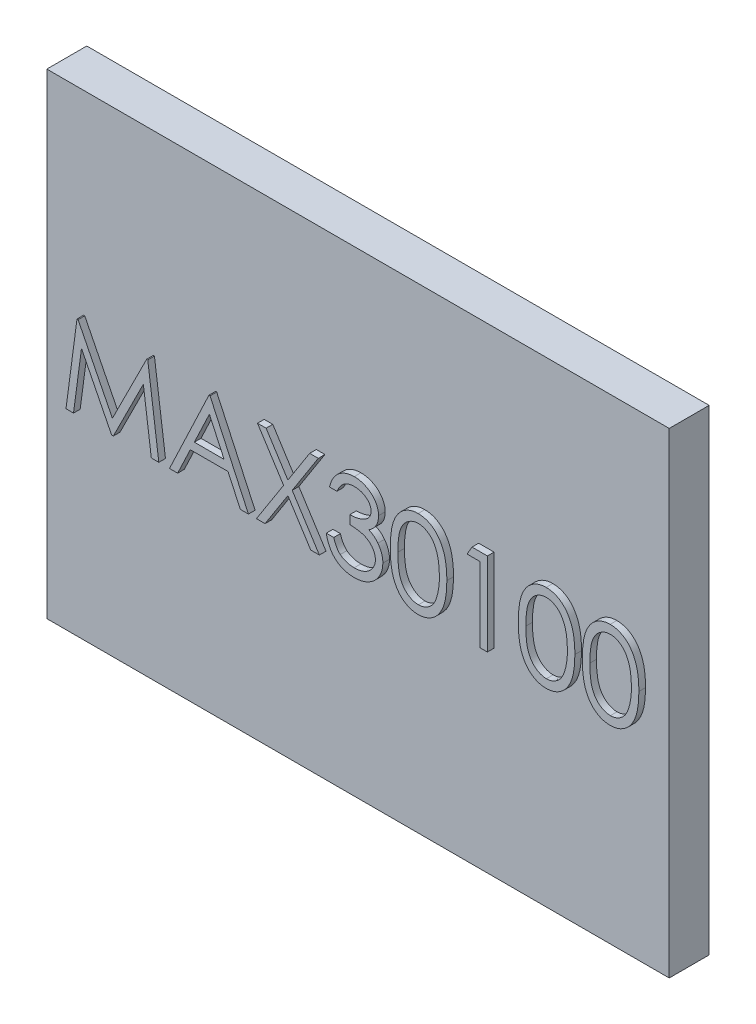
from build123d import *

# Parameters (mm, degrees)
SKETCH1_W           = 18.7
SKETCH1_H           = 14.3
BOSS_EXTRUDE1_DEPTH = 1.2
BOSS_EXTRUDE2_DEPTH = 0.2


with BuildPart() as part:
    # Sketch1 → Boss-Extrude1 (new body)
    with BuildSketch(Plane.XY):
        Rectangle(SKETCH1_W, SKETCH1_H)
    extrude(amount=BOSS_EXTRUDE1_DEPTH)

    # Sketch2 → Boss-Extrude2 (add)
    # profile 1 of 8: a face of its own
    with BuildSketch(Plane.XY.offset(1.2)):
        Polygon((-8.573717949, -1.2), (-8.243689904, 1.3), (-8.211638622, 1.3), (-7.179487179, -0.751282051), (-6.149839744, 1.3), (-6.11728766, 1.3), (-5.78525641, -1.2), (-6.010616987, -1.2), (-6.25, 0.598878205), (-7.15244391, -1.2), (-7.20302484, -1.2), (-8.108974359, 0.602884615), (-8.347856571, -1.2), align=None)
    # profile 2 of 8: a face of its own
    with BuildSketch(Plane.XY.offset(1.2)):
        Polygon((-4.246794872, 1.3), (-3.092948718, -1.2), (-3.336838942, -1.2), (-3.706430288, -0.398717949), (-4.83974359, -0.398717949), (-5.219851763, -1.2), (-5.46474359, -1.2), (-4.278846154, 1.3), align=None)
        Polygon((-4.265324519, 0.812720353), (-4.718048878, -0.142307692), (-3.824619391, -0.142307692), align=None, mode=Mode.SUBTRACT)
    # profile 3 of 8: a face of its own
    with BuildSketch(Plane.XY.offset(1.2)):
        Polygon((-2.820512821, 1.3), (-2.561598558, 1.3), (-1.907051282, 0.277363782), (-1.252504006, 1.3), (-0.993589744, 1.3), (-1.77734375, 0.075040064), (-0.961538462, -1.2), (-1.220452724, -1.2), (-1.907051282, -0.127283654), (-2.59364984, -1.2), (-2.852564103, -1.2), (-2.036258013, 0.075040064), align=None)
    # profile 4 of 8: a face of its own
    with BuildSketch(Plane.XY.offset(1.2)):
        with BuildLine():
            Line((-0.432692308, 0.723076923), (-0.657051282, 0.723076923))
            add(Edge.make_bspline(
                [(-0.657051282, 0.723076923), (-0.650973032, 0.748242983), (-0.639090549, 0.797440572), (-0.614306568, 0.867731473), (-0.5873071, 0.934248274), (-0.554886311, 0.995745469), (-0.519522915, 1.053458971), (-0.479006685, 1.106079774), (-0.435206884, 1.154946178), (-0.386760491, 1.198312776), (-0.335954304, 1.237582583), (-0.282072433, 1.271064767), (-0.226198938, 1.299867733), (-0.1679467, 1.32359647), (-0.107142291, 1.341471844), (-0.044335418, 1.354440991), (0.020638511, 1.362863215), (0.064743933, 1.363685189), (0.087139423, 1.364102564)],
                knots=[0, 0, 0, 0, 1.162005537, 2.271625781, 3.343758855, 4.383309926, 5.390229558, 6.379919256, 7.361854164, 8.333198761, 9.295911338, 10.242430842, 11.177959212, 12.116337295, 13.062827104, 14.020064771, 14.994644689, 16, 16, 16, 16], degree=3))
            add(Edge.make_bspline(
                [(0.087139423, 1.364102564), (0.119769953, 1.3631174), (0.184319247, 1.36116856), (0.279149994, 1.343372534), (0.370597722, 1.315211725), (0.457661471, 1.27630192), (0.53853178, 1.228310982), (0.610486199, 1.171193313), (0.672549421, 1.106050955), (0.724616834, 1.034099123), (0.76538469, 0.957202331), (0.795446385, 0.878059361), (0.813747586, 0.796857953), (0.816119412, 0.742031325), (0.817307692, 0.714563301)],
                knots=[0, 0, 0, 0, 1.083050992, 2.142477498, 3.193116406, 4.255571735, 5.30263384, 6.308962982, 7.297363603, 8.282367274, 9.249857812, 10.179914175, 11.08814088, 12, 12, 12, 12], degree=3))
            add(Edge.make_bspline(
                [(0.817307692, 0.714563301), (0.816476556, 0.688129876), (0.814850151, 0.636403766), (0.801040361, 0.560888411), (0.777800173, 0.489715839), (0.745607486, 0.422586438), (0.70393495, 0.359925838), (0.653454452, 0.301593059), (0.593809694, 0.247329374), (0.548610452, 0.216244037), (0.525340545, 0.200240385)],
                knots=[0, 0, 0, 0, 1.024540389, 2.004866551, 2.965041327, 3.920577974, 4.882998113, 5.874504559, 6.905732034, 8, 8, 8, 8], degree=3))
            add(Edge.make_bspline(
                [(0.525340545, 0.200240385), (0.551934655, 0.187398834), (0.60462528, 0.161956007), (0.676447087, 0.112059037), (0.741645569, 0.05444736), (0.778005368, 0.009488323), (0.796274038, -0.013100962)],
                knots=[0, 0, 0, 0, 1.015518401, 2.012035669, 3.001164323, 4, 4, 4, 4], degree=3))
            add(Edge.make_bspline(
                [(0.796274038, -0.013100962), (0.808303569, -0.029570784), (0.832165637, -0.062240725), (0.86161959, -0.114766743), (0.888340386, -0.16787495), (0.909161971, -0.222988811), (0.925286162, -0.279469535), (0.936811899, -0.337414104), (0.943972, -0.396869834), (0.944997394, -0.437093034), (0.945512821, -0.457311699)],
                knots=[0, 0, 0, 0, 1.025084078, 2.033381695, 3.024893161, 4.013698104, 4.991890475, 5.976764909, 6.982997093, 8, 8, 8, 8], degree=3))
            add(Edge.make_bspline(
                [(0.945512821, -0.457311699), (0.944231025, -0.492318642), (0.941673467, -0.562167787), (0.918813413, -0.665364016), (0.883375384, -0.766239375), (0.833049002, -0.862721403), (0.771715067, -0.952993104), (0.698745549, -1.033761896), (0.614969543, -1.103189471), (0.521536937, -1.161196776), (0.420310417, -1.207566721), (0.312042137, -1.239750608), (0.198292098, -1.260712037), (0.120286886, -1.2629598), (0.080629006, -1.264102564)],
                knots=[0, 0, 0, 0, 0.955779014, 1.907060117, 2.875433937, 3.871313158, 4.872415639, 5.851225146, 6.836215519, 7.83643374, 8.849228613, 9.86973379, 10.916971861, 12, 12, 12, 12], degree=3))
            add(Edge.make_bspline(
                [(0.080629006, -1.264102564), (0.053900935, -1.263482412), (0.001309003, -1.262262159), (-0.076007782, -1.253920301), (-0.149808996, -1.238684583), (-0.220194423, -1.218182222), (-0.287226592, -1.19218812), (-0.350700953, -1.159817622), (-0.411008019, -1.121737977), (-0.467578699, -1.0774997), (-0.520406247, -1.028013029), (-0.568086764, -0.972399451), (-0.611415188, -0.911687019), (-0.649231358, -0.845170551), (-0.683257753, -0.773709652), (-0.711244151, -0.696389296), (-0.7358767, -0.613900709), (-0.747329174, -0.556416609), (-0.753205128, -0.526923077)],
                knots=[0, 0, 0, 0, 1.048658725, 2.063410685, 3.046034179, 4.001477787, 4.936774919, 5.862367409, 6.792675028, 7.730719943, 8.675894397, 9.627829632, 10.600096036, 11.597688215, 12.626045268, 13.701542398, 14.82072376, 16, 16, 16, 16], degree=3))
            Line((-0.753205128, -0.526923077), (-0.528846154, -0.526923077))
            add(Edge.make_bspline(
                [(-0.528846154, -0.526923077), (-0.523000946, -0.546172372), (-0.511631508, -0.583613923), (-0.492278438, -0.637499856), (-0.470229672, -0.686898465), (-0.446576416, -0.732172124), (-0.421734669, -0.773766697), (-0.393938294, -0.810582318), (-0.365246047, -0.844236034), (-0.343617938, -0.863196471), (-0.333032853, -0.872475962)],
                knots=[0, 0, 0, 0, 1.198163088, 2.33053128, 3.407730985, 4.417276592, 5.372219308, 6.28897303, 7.162600585, 8, 8, 8, 8], degree=3))
            add(Edge.make_bspline(
                [(-0.333032853, -0.872475962), (-0.319035298, -0.883267629), (-0.291083396, -0.904817651), (-0.245534659, -0.932318815), (-0.197631169, -0.956148118), (-0.146334973, -0.974350758), (-0.092752995, -0.989763373), (-0.036019162, -0.999849458), (0.023365993, -1.00676958), (0.063914395, -1.007380246), (0.084635417, -1.007692308)],
                knots=[0, 0, 0, 0, 0.946170439, 1.889420265, 2.845303464, 3.807233317, 4.801018734, 5.828864929, 6.890507805, 8, 8, 8, 8], degree=3))
            add(Edge.make_bspline(
                [(0.084635417, -1.007692308), (0.108030776, -1.007252375), (0.153778381, -1.006392126), (0.220531852, -0.998480907), (0.284037171, -0.986959183), (0.343589261, -0.969164195), (0.399968195, -0.947177872), (0.452383659, -0.919571869), (0.501523735, -0.887182782), (0.546759024, -0.850369097), (0.587434387, -0.810068029), (0.623248325, -0.767915835), (0.653694512, -0.724090243), (0.67825421, -0.678348728), (0.697647461, -0.630880707), (0.710849747, -0.581552972), (0.7200294, -0.53076921), (0.720776981, -0.496248518), (0.721153846, -0.478846154)],
                knots=[0, 0, 0, 0, 1.217147791, 2.380027433, 3.494444702, 4.572153297, 5.609568379, 6.639424714, 7.649109417, 8.668170816, 9.669597737, 10.625200337, 11.543417969, 12.441394052, 13.322311151, 14.205496177, 15.095365482, 16, 16, 16, 16], degree=3))
            add(Edge.make_bspline(
                [(0.721153846, -0.478846154), (0.720060774, -0.45555234), (0.717880068, -0.40908062), (0.701231082, -0.340710924), (0.673846179, -0.274837058), (0.635508671, -0.212582922), (0.588840294, -0.15488585), (0.534293932, -0.10340622), (0.471416626, -0.060927583), (0.413545291, -0.031578543), (0.362284464, -0.011552061), (0.318416333, 0.0017872), (0.269304473, 0.013082668), (0.215542795, 0.023591433), (0.156726212, 0.032535254), (0.092918757, 0.039993693), (0.024107498, 0.04596158), (-0.023529049, 0.048626648), (-0.048076923, 0.05)],
                knots=[0, 0, 0, 0, 1.07054697, 2.135767047, 3.216561865, 4.33974944, 5.486079747, 6.621378074, 7.775625952, 8.963672916, 9.598146892, 10.304877434, 11.070270905, 11.915000392, 12.823868403, 13.805723172, 14.86925407, 16, 16, 16, 16], degree=3))
            Line((-0.048076923, 0.05), (-0.048076923, 0.306410256))
            add(Edge.make_bspline(
                [(-0.048076923, 0.306410256), (-0.017147519, 0.306935116), (0.043435586, 0.307963188), (0.131931518, 0.320397481), (0.216555312, 0.337597929), (0.295431556, 0.363944495), (0.367323494, 0.394544707), (0.429694639, 0.430153428), (0.481671173, 0.469735392), (0.523000509, 0.513901542), (0.554092816, 0.561269433), (0.576826242, 0.610638474), (0.590255047, 0.662441375), (0.592047666, 0.697794709), (0.592948718, 0.715564904)],
                knots=[0, 0, 0, 0, 1.321986639, 2.589447074, 3.816329219, 5.01088745, 6.139805852, 7.153945165, 8.075214402, 8.924034688, 9.728124013, 10.488707548, 11.240355623, 12, 12, 12, 12], degree=3))
            add(Edge.make_bspline(
                [(0.592948718, 0.715564904), (0.59265271, 0.728620436), (0.592063817, 0.754593798), (0.58463719, 0.792540276), (0.57347716, 0.829326666), (0.558134497, 0.86479653), (0.53759864, 0.898703869), (0.513022936, 0.931337761), (0.483760007, 0.962511889), (0.450227545, 0.99156926), (0.414219113, 1.019261572), (0.374754988, 1.042771313), (0.333025077, 1.062874929), (0.288983181, 1.079453144), (0.242486373, 1.091924065), (0.193753118, 1.100878237), (0.142690487, 1.106476562), (0.107853535, 1.107282573), (0.090144231, 1.107692308)],
                knots=[0, 0, 0, 0, 0.884392785, 1.759457502, 2.611959086, 3.489218968, 4.37281399, 5.2945488, 6.255912374, 7.266815255, 8.301784654, 9.332968512, 10.37626691, 11.440494194, 12.520033166, 13.637162961, 14.798855837, 16, 16, 16, 16], degree=3))
            add(Edge.make_bspline(
                [(0.090144231, 1.107692308), (0.061678754, 1.106698478), (0.006079056, 1.104757297), (-0.074074456, 1.087755144), (-0.148588266, 1.060627942), (-0.205544456, 1.028247213), (-0.247603438, 0.996282618), (-0.277658394, 0.968366628), (-0.307173044, 0.937343182), (-0.33420567, 0.901301485), (-0.361544225, 0.86268235), (-0.386433198, 0.819522577), (-0.410618692, 0.77294801), (-0.425191942, 0.740022556), (-0.432692308, 0.723076923)],
                knots=[0, 0, 0, 0, 1.472543308, 2.876219568, 4.221790263, 5.565193594, 6.249813518, 6.953379497, 7.687249741, 8.463570142, 9.283606569, 10.136032583, 11.040678096, 12, 12, 12, 12], degree=3))
        make_face()
    # profile 5 of 8: a face of its own
    with BuildSketch(Plane.XY.offset(1.2)):
        with BuildLine():
            add(Edge.make_bspline(
                [(1.169871795, 0.048998397), (1.170106094, 0.08906796), (1.170561222, 0.166903663), (1.17562438, 0.280321265), (1.184035339, 0.386721471), (1.195562034, 0.486109375), (1.209589162, 0.578510636), (1.22831451, 0.663678319), (1.249609369, 0.74200661), (1.274289687, 0.81375093), (1.302138108, 0.879877861), (1.332448294, 0.941610148), (1.366423147, 0.998854385), (1.402120942, 1.052524235), (1.440986708, 1.10174116), (1.481914415, 1.147200205), (1.52650147, 1.187850741), (1.57323219, 1.224883814), (1.622529665, 1.257347722), (1.672988712, 1.285942536), (1.724956645, 1.310371012), (1.778575347, 1.329578466), (1.833362888, 1.345443357), (1.889510793, 1.356292605), (1.947111767, 1.363118968), (1.985991363, 1.363771588), (2.005709135, 1.364102564)],
                knots=[0, 0, 0, 0, 1.646270934, 3.197905019, 4.663502075, 6.030701355, 7.308322542, 8.50163776, 9.611534131, 10.641858119, 11.616356847, 12.558055219, 13.465016945, 14.349605745, 15.204443733, 16.039544428, 16.859896111, 17.680448484, 18.487036065, 19.28249412, 20.06191084, 20.843045899, 21.620316918, 22.403196591, 23.190181807, 24, 24, 24, 24], degree=3))
            add(Edge.make_bspline(
                [(2.005709135, 1.364102564), (2.025591619, 1.363754125), (2.065131626, 1.363061188), (2.123589036, 1.356401229), (2.180695952, 1.345350427), (2.236208908, 1.329692588), (2.290583899, 1.310267105), (2.343395618, 1.285919164), (2.394972105, 1.257577116), (2.444493739, 1.224274346), (2.492504179, 1.187144149), (2.537824152, 1.145170814), (2.580457785, 1.098778158), (2.620940146, 1.048462541), (2.658122715, 0.993258909), (2.69353231, 0.934127402), (2.725226621, 0.870033927), (2.755751389, 0.802047878), (2.782099237, 0.728288122), (2.805860841, 0.649170436), (2.825060104, 0.563760302), (2.841052441, 0.472505842), (2.853441653, 0.375071925), (2.862464968, 0.271667414), (2.867231458, 0.162224278), (2.868129101, 0.087397243), (2.868589744, 0.048998397)],
                knots=[0, 0, 0, 0, 0.810914788, 1.612654377, 2.396697861, 3.181598691, 3.963628158, 4.749916497, 5.551656086, 6.361998678, 7.18212741, 8.025565596, 8.878627764, 9.750805457, 10.657531673, 11.591944965, 12.560506719, 13.57287815, 14.630710178, 15.753379473, 16.941251878, 18.199788006, 19.531962791, 20.947069417, 22.433333509, 24, 24, 24, 24], degree=3))
            add(Edge.make_bspline(
                [(2.868589744, 0.048998397), (2.868124326, 0.010767035), (2.867217479, -0.063725217), (2.862518403, -0.172675913), (2.853262238, -0.275531659), (2.841683675, -0.372539132), (2.825647272, -0.463294574), (2.805929296, -0.548112037), (2.784036209, -0.627357802), (2.757011356, -0.700382668), (2.727432277, -0.768205327), (2.695249994, -0.831539004), (2.660771547, -0.890943499), (2.623208158, -0.945943318), (2.583170005, -0.996928074), (2.539800156, -1.042997804), (2.494321167, -1.08526257), (2.446169441, -1.122870875), (2.395875476, -1.155788593), (2.344476135, -1.185227057), (2.291059433, -1.208964696), (2.236835895, -1.229346869), (2.181029919, -1.24491862), (2.123711069, -1.25568566), (2.0651709, -1.26323698), (2.025598354, -1.263813037), (2.005709135, -1.264102564)],
                knots=[0, 0, 0, 0, 1.561518951, 3.042555995, 4.452378317, 5.7783523, 7.031515105, 8.214008947, 9.334062868, 10.386615937, 11.391082383, 12.354592575, 13.286541444, 14.194233754, 15.072674879, 15.931287219, 16.775624067, 17.606195743, 18.42308326, 19.229000347, 20.022332153, 20.807536673, 21.593273796, 22.3848459, 23.188221202, 24, 24, 24, 24], degree=3))
            add(Edge.make_bspline(
                [(2.005709135, -1.264102564), (1.98599191, -1.263769453), (1.947113393, -1.263112623), (1.889504517, -1.256317101), (1.833588486, -1.245391741), (1.779089376, -1.230094167), (1.72572758, -1.211369284), (1.674230232, -1.186973795), (1.624024744, -1.158878032), (1.575245061, -1.126881302), (1.528807803, -1.090222957), (1.484451656, -1.049677037), (1.443290928, -1.004231743), (1.40498086, -0.954604655), (1.368570797, -0.901252339), (1.335078388, -0.843446358), (1.304099206, -0.781415922), (1.275782427, -0.714760272), (1.250676239, -0.642506752), (1.228499305, -0.563828767), (1.210989192, -0.478031884), (1.196001367, -0.385805193), (1.183912522, -0.286752386), (1.175659432, -0.180819687), (1.170558493, -0.06807311), (1.170104871, 0.009262444), (1.169871795, 0.048998397)],
                knots=[0, 0, 0, 0, 0.810891512, 1.598919785, 2.382837074, 3.152667961, 3.926044502, 4.706494248, 5.493654104, 6.291793342, 7.103789334, 7.925228297, 8.761435821, 9.622817696, 10.50288917, 11.416980706, 12.369136599, 13.353924996, 14.394355917, 15.514179734, 16.714354668, 17.994756427, 19.357759367, 20.818452758, 22.365282078, 24, 24, 24, 24], degree=3))
        make_face()
        with BuildLine():
            add(Edge.make_bspline(
                [(1.394230769, 0.05), (1.394316089, 0.016608072), (1.394481677, -0.048199103), (1.398807534, -0.14237286), (1.404700557, -0.23020881), (1.412301484, -0.311818478), (1.423589304, -0.38692563), (1.43623701, -0.456046832), (1.451628502, -0.518816288), (1.469839229, -0.575664724), (1.490581441, -0.627556916), (1.513228487, -0.675843498), (1.537557575, -0.721094881), (1.564785539, -0.762904601), (1.594439156, -0.801409004), (1.625848627, -0.837289599), (1.660186187, -0.869287442), (1.70768886, -0.907663767), (1.770400627, -0.947320292), (1.849415238, -0.981853213), (1.930606989, -1.003554967), (1.985715025, -1.006314793), (2.013221154, -1.007692308)],
                knots=[0, 0, 0, 0, 1.459021318, 2.831673884, 4.118529203, 5.306027144, 6.411944654, 7.436330062, 8.375795394, 9.233974572, 10.042671642, 10.816086306, 11.563610507, 12.285937304, 12.993564865, 13.685989202, 14.367179055, 15.041617293, 16.353048772, 17.594441528, 18.799311195, 20, 20, 20, 20], degree=3))
            add(Edge.make_bspline(
                [(2.013221154, -1.007692308), (2.040905205, -1.006551036), (2.09621615, -1.004270848), (2.177026004, -0.98227175), (2.255476197, -0.949079222), (2.316956154, -0.909831003), (2.363729399, -0.872453625), (2.397241535, -0.840586019), (2.428000141, -0.804903257), (2.457173052, -0.76640376), (2.483929535, -0.724351986), (2.508260347, -0.678950146), (2.530462738, -0.630072162), (2.543112057, -0.59595092), (2.549579327, -0.578505609)],
                knots=[0, 0, 0, 0, 1.353760809, 2.704726607, 4.075137775, 5.516104923, 6.260822281, 7.007110065, 7.778089737, 8.566572457, 9.372053459, 10.217411131, 11.088608312, 12, 12, 12, 12], degree=3))
            add(Edge.make_bspline(
                [(2.549579327, -0.578505609), (2.557116304, -0.556198652), (2.5724196, -0.510905963), (2.592142295, -0.440646212), (2.607674723, -0.366929952), (2.621648556, -0.290197726), (2.631186453, -0.209883654), (2.638863463, -0.126236237), (2.643385382, -0.039192406), (2.643945918, 0.019946873), (2.644230769, 0.05)],
                knots=[0, 0, 0, 0, 0.884706709, 1.796334032, 2.740027952, 3.714592787, 4.726048262, 5.777819803, 6.87074269, 8, 8, 8, 8], degree=3))
            add(Edge.make_bspline(
                [(2.644230769, 0.05), (2.643837777, 0.080048266), (2.643069, 0.138829098), (2.640130437, 0.224913513), (2.63254217, 0.306676199), (2.624114228, 0.384469394), (2.611687641, 0.457862467), (2.598289208, 0.527469828), (2.580288342, 0.592429132), (2.561059931, 0.653757404), (2.539052506, 0.710757872), (2.514826981, 0.763696291), (2.488954296, 0.812828237), (2.460852696, 0.858018909), (2.43085578, 0.899470726), (2.398171816, 0.936352579), (2.364097264, 0.969807556), (2.316370703, 1.007995106), (2.253889067, 1.046932031), (2.176142176, 1.082764717), (2.095234573, 1.103342068), (2.040539249, 1.106243274), (2.013221154, 1.107692308)],
                knots=[0, 0, 0, 0, 1.31362396, 2.569729283, 3.763502607, 4.902122613, 5.988968491, 7.01645872, 7.998833611, 8.933434873, 9.825090667, 10.667526885, 11.477055099, 12.250526234, 12.991942729, 13.710640831, 14.402115721, 15.076753259, 16.378508321, 17.609869233, 18.806226677, 20, 20, 20, 20], degree=3))
            add(Edge.make_bspline(
                [(2.013221154, 1.107692308), (1.985570731, 1.106241274), (1.930219513, 1.103336564), (1.848470974, 1.082841383), (1.770110722, 1.047117836), (1.707794312, 1.007866141), (1.660034464, 0.970481633), (1.626403969, 0.938062738), (1.594870989, 0.902601127), (1.565822632, 0.863742617), (1.538616001, 0.82198164), (1.513629563, 0.776989665), (1.491117185, 0.728538691), (1.470342516, 0.676669808), (1.452076239, 0.619826277), (1.437009123, 0.557134138), (1.423089799, 0.488232787), (1.413236035, 0.412718853), (1.40447621, 0.331088743), (1.398846676, 0.243033516), (1.394467206, 0.148701816), (1.39431116, 0.08355956), (1.394230769, 0.05)],
                knots=[0, 0, 0, 0, 1.207732386, 2.417664972, 3.655092373, 4.956220595, 5.625982001, 6.301752483, 6.994047911, 7.697131622, 8.419323945, 9.170223765, 9.943494443, 10.752040957, 11.610060368, 12.549350801, 13.567764191, 14.679664412, 15.874934091, 17.154273443, 18.533957287, 20, 20, 20, 20], degree=3))
        make_face(mode=Mode.SUBTRACT)
    # profile 6 of 8: a face of its own
    with BuildSketch(Plane.XY.offset(1.2)):
        Polygon((3.624298878, 1.3), (4.086538462, 1.3), (4.086538462, -1.2), (3.862179487, -1.2), (3.862179487, 1.043589744), (3.477564103, 1.043589744), align=None)
    # profile 7 of 8: a face of its own
    with BuildSketch(Plane.XY.offset(1.2)):
        with BuildLine():
            add(Edge.make_bspline(
                [(5.016025641, 0.048998397), (5.01625994, 0.08906796), (5.016715068, 0.166903663), (5.021778226, 0.280321265), (5.030189185, 0.386721471), (5.04171588, 0.486109375), (5.055743009, 0.578510636), (5.074468356, 0.663678319), (5.095763215, 0.74200661), (5.120443534, 0.81375093), (5.148291954, 0.879877861), (5.17860214, 0.941610148), (5.212576994, 0.998854385), (5.248274789, 1.052524235), (5.287140554, 1.10174116), (5.328068262, 1.147200205), (5.372655316, 1.187850741), (5.419386036, 1.224883814), (5.468683511, 1.257347722), (5.519142558, 1.285942536), (5.571110491, 1.310371012), (5.624729193, 1.329578466), (5.679516734, 1.345443357), (5.735664639, 1.356292605), (5.793265613, 1.363118968), (5.832145209, 1.363771588), (5.851862981, 1.364102564)],
                knots=[0, 0, 0, 0, 1.646270934, 3.197905019, 4.663502075, 6.030701355, 7.308322542, 8.50163776, 9.611534131, 10.641858119, 11.616356847, 12.558055219, 13.465016945, 14.349605745, 15.204443733, 16.039544428, 16.859896111, 17.680448484, 18.487036065, 19.28249412, 20.06191084, 20.843045899, 21.620316918, 22.403196591, 23.190181807, 24, 24, 24, 24], degree=3))
            add(Edge.make_bspline(
                [(5.851862981, 1.364102564), (5.871745465, 1.363754125), (5.911285472, 1.363061188), (5.969742883, 1.356401229), (6.026849798, 1.345350427), (6.082362754, 1.329692588), (6.136737745, 1.310267105), (6.189549464, 1.285919164), (6.241125951, 1.257577116), (6.290647585, 1.224274346), (6.338658025, 1.187144149), (6.383977998, 1.145170814), (6.426611631, 1.098778158), (6.467093992, 1.048462541), (6.504276562, 0.993258909), (6.539686156, 0.934127402), (6.571380467, 0.870033927), (6.601905235, 0.802047878), (6.628253083, 0.728288122), (6.652014687, 0.649170436), (6.67121395, 0.563760302), (6.687206287, 0.472505842), (6.699595499, 0.375071925), (6.708618815, 0.271667414), (6.713385304, 0.162224278), (6.714282948, 0.087397243), (6.71474359, 0.048998397)],
                knots=[0, 0, 0, 0, 0.810914788, 1.612654377, 2.396697861, 3.181598691, 3.963628158, 4.749916497, 5.551656086, 6.361998678, 7.18212741, 8.025565596, 8.878627764, 9.750805457, 10.657531673, 11.591944965, 12.560506719, 13.57287815, 14.630710178, 15.753379473, 16.941251878, 18.199788006, 19.531962791, 20.947069417, 22.433333509, 24, 24, 24, 24], degree=3))
            add(Edge.make_bspline(
                [(6.71474359, 0.048998397), (6.714278172, 0.010767035), (6.713371325, -0.063725217), (6.708672249, -0.172675913), (6.699416084, -0.275531659), (6.687837521, -0.372539132), (6.671801119, -0.463294574), (6.652083143, -0.548112037), (6.630190055, -0.627357802), (6.603165202, -0.700382668), (6.573586123, -0.768205327), (6.54140384, -0.831539004), (6.506925393, -0.890943499), (6.469362004, -0.945943318), (6.429323851, -0.996928074), (6.385954002, -1.042997804), (6.340475013, -1.08526257), (6.292323287, -1.122870875), (6.242029322, -1.155788593), (6.190629981, -1.185227057), (6.137213279, -1.208964696), (6.082989741, -1.229346869), (6.027183766, -1.24491862), (5.969864915, -1.25568566), (5.911324747, -1.26323698), (5.8717522, -1.263813037), (5.851862981, -1.264102564)],
                knots=[0, 0, 0, 0, 1.561518951, 3.042555995, 4.452378317, 5.7783523, 7.031515105, 8.214008947, 9.334062868, 10.386615937, 11.391082383, 12.354592575, 13.286541444, 14.194233754, 15.072674879, 15.931287219, 16.775624067, 17.606195743, 18.42308326, 19.229000347, 20.022332153, 20.807536673, 21.593273796, 22.3848459, 23.188221202, 24, 24, 24, 24], degree=3))
            add(Edge.make_bspline(
                [(5.851862981, -1.264102564), (5.832145756, -1.263769453), (5.793267239, -1.263112623), (5.735658363, -1.256317101), (5.679742332, -1.245391741), (5.625243222, -1.230094167), (5.571881426, -1.211369284), (5.520384078, -1.186973795), (5.47017859, -1.158878032), (5.421398907, -1.126881302), (5.374961649, -1.090222957), (5.330605503, -1.049677037), (5.289444775, -1.004231743), (5.251134706, -0.954604655), (5.214724643, -0.901252339), (5.181232234, -0.843446358), (5.150253052, -0.781415922), (5.121936273, -0.714760272), (5.096830085, -0.642506752), (5.074653151, -0.563828767), (5.057143038, -0.478031884), (5.042155213, -0.385805193), (5.030066368, -0.286752386), (5.021813278, -0.180819687), (5.016712339, -0.06807311), (5.016258717, 0.009262444), (5.016025641, 0.048998397)],
                knots=[0, 0, 0, 0, 0.810891512, 1.598919785, 2.382837074, 3.152667961, 3.926044502, 4.706494248, 5.493654104, 6.291793342, 7.103789334, 7.925228297, 8.761435821, 9.622817696, 10.50288917, 11.416980706, 12.369136599, 13.353924996, 14.394355917, 15.514179734, 16.714354668, 17.994756427, 19.357759367, 20.818452758, 22.365282078, 24, 24, 24, 24], degree=3))
        make_face()
        with BuildLine():
            add(Edge.make_bspline(
                [(5.240384615, 0.05), (5.240469935, 0.016608072), (5.240635523, -0.048199103), (5.24496138, -0.14237286), (5.250854403, -0.23020881), (5.25845533, -0.311818478), (5.26974315, -0.38692563), (5.282390856, -0.456046832), (5.297782348, -0.518816288), (5.315993075, -0.575664724), (5.336735287, -0.627556916), (5.359382333, -0.675843498), (5.383711421, -0.721094881), (5.410939385, -0.762904601), (5.440593002, -0.801409004), (5.472002473, -0.837289599), (5.506340033, -0.869287442), (5.553842706, -0.907663767), (5.616554474, -0.947320292), (5.695569085, -0.981853213), (5.776760835, -1.003554967), (5.831868871, -1.006314793), (5.859375, -1.007692308)],
                knots=[0, 0, 0, 0, 1.459021318, 2.831673884, 4.118529203, 5.306027144, 6.411944654, 7.436330062, 8.375795394, 9.233974572, 10.042671642, 10.816086306, 11.563610507, 12.285937304, 12.993564865, 13.685989202, 14.367179055, 15.041617293, 16.353048772, 17.594441528, 18.799311195, 20, 20, 20, 20], degree=3))
            add(Edge.make_bspline(
                [(5.859375, -1.007692308), (5.887059051, -1.006551036), (5.942369996, -1.004270848), (6.02317985, -0.98227175), (6.101630043, -0.949079222), (6.16311, -0.909831003), (6.209883246, -0.872453625), (6.243395381, -0.840586019), (6.274153987, -0.804903257), (6.303326898, -0.76640376), (6.330083381, -0.724351986), (6.354414193, -0.678950146), (6.376616584, -0.630072162), (6.389265903, -0.59595092), (6.395733173, -0.578505609)],
                knots=[0, 0, 0, 0, 1.353760809, 2.704726607, 4.075137775, 5.516104923, 6.260822281, 7.007110065, 7.778089737, 8.566572457, 9.372053459, 10.217411131, 11.088608312, 12, 12, 12, 12], degree=3))
            add(Edge.make_bspline(
                [(6.395733173, -0.578505609), (6.40327015, -0.556198652), (6.418573446, -0.510905963), (6.438296142, -0.440646212), (6.45382857, -0.366929952), (6.467802402, -0.290197726), (6.477340299, -0.209883654), (6.485017309, -0.126236237), (6.489539228, -0.039192406), (6.490099765, 0.019946873), (6.490384615, 0.05)],
                knots=[0, 0, 0, 0, 0.884706709, 1.796334032, 2.740027952, 3.714592787, 4.726048262, 5.777819803, 6.87074269, 8, 8, 8, 8], degree=3))
            add(Edge.make_bspline(
                [(6.490384615, 0.05), (6.489991623, 0.080048266), (6.489222846, 0.138829098), (6.486284283, 0.224913513), (6.478696016, 0.306676199), (6.470268074, 0.384469394), (6.457841487, 0.457862467), (6.444443054, 0.527469828), (6.426442188, 0.592429132), (6.407213777, 0.653757404), (6.385206352, 0.710757872), (6.360980827, 0.763696291), (6.335108143, 0.812828237), (6.307006542, 0.858018909), (6.277009626, 0.899470726), (6.244325662, 0.936352579), (6.21025111, 0.969807556), (6.162524549, 1.007995106), (6.100042913, 1.046932031), (6.022296022, 1.082764717), (5.941388419, 1.103342068), (5.886693095, 1.106243274), (5.859375, 1.107692308)],
                knots=[0, 0, 0, 0, 1.31362396, 2.569729283, 3.763502607, 4.902122613, 5.988968491, 7.01645872, 7.998833611, 8.933434873, 9.825090667, 10.667526885, 11.477055099, 12.250526234, 12.991942729, 13.710640831, 14.402115721, 15.076753259, 16.378508321, 17.609869233, 18.806226677, 20, 20, 20, 20], degree=3))
            add(Edge.make_bspline(
                [(5.859375, 1.107692308), (5.831724577, 1.106241274), (5.776373359, 1.103336564), (5.69462482, 1.082841383), (5.616264569, 1.047117836), (5.553948158, 1.007866141), (5.506188311, 0.970481633), (5.472557815, 0.938062738), (5.441024835, 0.902601127), (5.411976478, 0.863742617), (5.384769847, 0.82198164), (5.359783409, 0.776989665), (5.337271031, 0.728538691), (5.316496362, 0.676669808), (5.298230085, 0.619826277), (5.283162969, 0.557134138), (5.269243645, 0.488232787), (5.259389882, 0.412718853), (5.250630056, 0.331088743), (5.245000522, 0.243033516), (5.240621052, 0.148701816), (5.240465006, 0.08355956), (5.240384615, 0.05)],
                knots=[0, 0, 0, 0, 1.207732386, 2.417664972, 3.655092373, 4.956220595, 5.625982001, 6.301752483, 6.994047911, 7.697131622, 8.419323945, 9.170223765, 9.943494443, 10.752040957, 11.610060368, 12.549350801, 13.567764191, 14.679664412, 15.874934091, 17.154273443, 18.533957287, 20, 20, 20, 20], degree=3))
        make_face(mode=Mode.SUBTRACT)
    # profile 8 of 8: a face of its own
    with BuildSketch(Plane.XY.offset(1.2)):
        with BuildLine():
            add(Edge.make_bspline(
                [(6.939102564, 0.048998397), (6.939336863, 0.08906796), (6.939791991, 0.166903663), (6.944855149, 0.280321265), (6.953266108, 0.386721471), (6.964792803, 0.486109375), (6.978819932, 0.578510636), (6.997545279, 0.663678319), (7.018840138, 0.74200661), (7.043520457, 0.81375093), (7.071368877, 0.879877861), (7.101679064, 0.941610148), (7.135653917, 0.998854385), (7.171351712, 1.052524235), (7.210217477, 1.10174116), (7.251145185, 1.147200205), (7.295732239, 1.187850741), (7.342462959, 1.224883814), (7.391760434, 1.257347722), (7.442219481, 1.285942536), (7.494187414, 1.310371012), (7.547806116, 1.329578466), (7.602593657, 1.345443357), (7.658741562, 1.356292605), (7.716342536, 1.363118968), (7.755222133, 1.363771588), (7.774939904, 1.364102564)],
                knots=[0, 0, 0, 0, 1.646270934, 3.197905019, 4.663502075, 6.030701355, 7.308322542, 8.50163776, 9.611534131, 10.641858119, 11.616356847, 12.558055219, 13.465016945, 14.349605745, 15.204443733, 16.039544428, 16.859896111, 17.680448484, 18.487036065, 19.28249412, 20.06191084, 20.843045899, 21.620316918, 22.403196591, 23.190181807, 24, 24, 24, 24], degree=3))
            add(Edge.make_bspline(
                [(7.774939904, 1.364102564), (7.794822388, 1.363754125), (7.834362395, 1.363061188), (7.892819806, 1.356401229), (7.949926721, 1.345350427), (8.005439677, 1.329692588), (8.059814668, 1.310267105), (8.112626388, 1.285919164), (8.164202874, 1.257577116), (8.213724508, 1.224274346), (8.261734948, 1.187144149), (8.307054921, 1.145170814), (8.349688554, 1.098778158), (8.390170915, 1.048462541), (8.427353485, 0.993258909), (8.462763079, 0.934127402), (8.49445739, 0.870033927), (8.524982158, 0.802047878), (8.551330006, 0.728288122), (8.57509161, 0.649170436), (8.594290873, 0.563760302), (8.610283211, 0.472505842), (8.622672422, 0.375071925), (8.631695738, 0.271667414), (8.636462227, 0.162224278), (8.637359871, 0.087397243), (8.637820513, 0.048998397)],
                knots=[0, 0, 0, 0, 0.810914788, 1.612654377, 2.396697861, 3.181598691, 3.963628158, 4.749916497, 5.551656086, 6.361998678, 7.18212741, 8.025565596, 8.878627764, 9.750805457, 10.657531673, 11.591944965, 12.560506719, 13.57287815, 14.630710178, 15.753379473, 16.941251878, 18.199788006, 19.531962791, 20.947069417, 22.433333509, 24, 24, 24, 24], degree=3))
            add(Edge.make_bspline(
                [(8.637820513, 0.048998397), (8.637355095, 0.010767035), (8.636448248, -0.063725217), (8.631749172, -0.172675913), (8.622493007, -0.275531659), (8.610914444, -0.372539132), (8.594878042, -0.463294574), (8.575160066, -0.548112037), (8.553266978, -0.627357802), (8.526242125, -0.700382668), (8.496663046, -0.768205327), (8.464480763, -0.831539004), (8.430002316, -0.890943499), (8.392438927, -0.945943318), (8.352400774, -0.996928074), (8.309030925, -1.042997804), (8.263551936, -1.08526257), (8.21540021, -1.122870875), (8.165106245, -1.155788593), (8.113706905, -1.185227057), (8.060290202, -1.208964696), (8.006066665, -1.229346869), (7.950260689, -1.24491862), (7.892941838, -1.25568566), (7.83440167, -1.26323698), (7.794829123, -1.263813037), (7.774939904, -1.264102564)],
                knots=[0, 0, 0, 0, 1.561518951, 3.042555995, 4.452378317, 5.7783523, 7.031515105, 8.214008947, 9.334062868, 10.386615937, 11.391082383, 12.354592575, 13.286541444, 14.194233754, 15.072674879, 15.931287219, 16.775624067, 17.606195743, 18.42308326, 19.229000347, 20.022332153, 20.807536673, 21.593273796, 22.3848459, 23.188221202, 24, 24, 24, 24], degree=3))
            add(Edge.make_bspline(
                [(7.774939904, -1.264102564), (7.75522268, -1.263769453), (7.716344162, -1.263112623), (7.658735287, -1.256317101), (7.602819256, -1.245391741), (7.548320146, -1.230094167), (7.494958349, -1.211369284), (7.443461001, -1.186973795), (7.393255513, -1.158878032), (7.34447583, -1.126881302), (7.298038572, -1.090222957), (7.253682426, -1.049677037), (7.212521698, -1.004231743), (7.174211629, -0.954604655), (7.137801566, -0.901252339), (7.104309157, -0.843446358), (7.073329975, -0.781415922), (7.045013196, -0.714760272), (7.019907008, -0.642506752), (6.997730074, -0.563828767), (6.980219961, -0.478031884), (6.965232136, -0.385805193), (6.953143291, -0.286752386), (6.944890202, -0.180819687), (6.939789262, -0.06807311), (6.939335641, 0.009262444), (6.939102564, 0.048998397)],
                knots=[0, 0, 0, 0, 0.810891512, 1.598919785, 2.382837074, 3.152667961, 3.926044502, 4.706494248, 5.493654104, 6.291793342, 7.103789334, 7.925228297, 8.761435821, 9.622817696, 10.50288917, 11.416980706, 12.369136599, 13.353924996, 14.394355917, 15.514179734, 16.714354668, 17.994756427, 19.357759367, 20.818452758, 22.365282078, 24, 24, 24, 24], degree=3))
        make_face()
        with BuildLine():
            add(Edge.make_bspline(
                [(7.163461538, 0.05), (7.163546858, 0.016608072), (7.163712446, -0.048199103), (7.168038303, -0.14237286), (7.173931326, -0.23020881), (7.181532253, -0.311818478), (7.192820073, -0.38692563), (7.205467779, -0.456046832), (7.220859271, -0.518816288), (7.239069998, -0.575664724), (7.259812211, -0.627556916), (7.282459256, -0.675843498), (7.306788344, -0.721094881), (7.334016308, -0.762904601), (7.363669925, -0.801409004), (7.395079396, -0.837289599), (7.429416956, -0.869287442), (7.476919629, -0.907663767), (7.539631397, -0.947320292), (7.618646008, -0.981853213), (7.699837758, -1.003554967), (7.754945794, -1.006314793), (7.782451923, -1.007692308)],
                knots=[0, 0, 0, 0, 1.459021318, 2.831673884, 4.118529203, 5.306027144, 6.411944654, 7.436330062, 8.375795394, 9.233974572, 10.042671642, 10.816086306, 11.563610507, 12.285937304, 12.993564865, 13.685989202, 14.367179055, 15.041617293, 16.353048772, 17.594441528, 18.799311195, 20, 20, 20, 20], degree=3))
            add(Edge.make_bspline(
                [(7.782451923, -1.007692308), (7.810135974, -1.006551036), (7.865446919, -1.004270848), (7.946256773, -0.98227175), (8.024706966, -0.949079222), (8.086186923, -0.909831003), (8.132960169, -0.872453625), (8.166472304, -0.840586019), (8.19723091, -0.804903257), (8.226403821, -0.76640376), (8.253160304, -0.724351986), (8.277491116, -0.678950146), (8.299693507, -0.630072162), (8.312342826, -0.59595092), (8.318810096, -0.578505609)],
                knots=[0, 0, 0, 0, 1.353760809, 2.704726607, 4.075137775, 5.516104923, 6.260822281, 7.007110065, 7.778089737, 8.566572457, 9.372053459, 10.217411131, 11.088608312, 12, 12, 12, 12], degree=3))
            add(Edge.make_bspline(
                [(8.318810096, -0.578505609), (8.326347073, -0.556198652), (8.341650369, -0.510905963), (8.361373065, -0.440646212), (8.376905493, -0.366929952), (8.390879325, -0.290197726), (8.400417222, -0.209883654), (8.408094232, -0.126236237), (8.412616151, -0.039192406), (8.413176688, 0.019946873), (8.413461538, 0.05)],
                knots=[0, 0, 0, 0, 0.884706709, 1.796334032, 2.740027952, 3.714592787, 4.726048262, 5.777819803, 6.87074269, 8, 8, 8, 8], degree=3))
            add(Edge.make_bspline(
                [(8.413461538, 0.05), (8.413068546, 0.080048266), (8.412299769, 0.138829098), (8.409361207, 0.224913513), (8.401772939, 0.306676199), (8.393344997, 0.384469394), (8.380918411, 0.457862467), (8.367519977, 0.527469828), (8.349519111, 0.592429132), (8.3302907, 0.653757404), (8.308283275, 0.710757872), (8.284057751, 0.763696291), (8.258185066, 0.812828237), (8.230083465, 0.858018909), (8.200086549, 0.899470726), (8.167402585, 0.936352579), (8.133328033, 0.969807556), (8.085601472, 1.007995106), (8.023119836, 1.046932031), (7.945372945, 1.082764717), (7.864465342, 1.103342068), (7.809770018, 1.106243274), (7.782451923, 1.107692308)],
                knots=[0, 0, 0, 0, 1.31362396, 2.569729283, 3.763502607, 4.902122613, 5.988968491, 7.01645872, 7.998833611, 8.933434873, 9.825090667, 10.667526885, 11.477055099, 12.250526234, 12.991942729, 13.710640831, 14.402115721, 15.076753259, 16.378508321, 17.609869233, 18.806226677, 20, 20, 20, 20], degree=3))
            add(Edge.make_bspline(
                [(7.782451923, 1.107692308), (7.7548015, 1.106241274), (7.699450282, 1.103336564), (7.617701743, 1.082841383), (7.539341492, 1.047117836), (7.477025081, 1.007866141), (7.429265234, 0.970481633), (7.395634738, 0.938062738), (7.364101758, 0.902601127), (7.335053401, 0.863742617), (7.30784677, 0.82198164), (7.282860333, 0.776989665), (7.260347954, 0.728538691), (7.239573286, 0.676669808), (7.221307008, 0.619826277), (7.206239892, 0.557134138), (7.192320568, 0.488232787), (7.182466805, 0.412718853), (7.173706979, 0.331088743), (7.168077445, 0.243033516), (7.163697975, 0.148701816), (7.163541929, 0.08355956), (7.163461538, 0.05)],
                knots=[0, 0, 0, 0, 1.207732386, 2.417664972, 3.655092373, 4.956220595, 5.625982001, 6.301752483, 6.994047911, 7.697131622, 8.419323945, 9.170223765, 9.943494443, 10.752040957, 11.610060368, 12.549350801, 13.567764191, 14.679664412, 15.874934091, 17.154273443, 18.533957287, 20, 20, 20, 20], degree=3))
        make_face(mode=Mode.SUBTRACT)
    extrude(amount=BOSS_EXTRUDE2_DEPTH)


solid = part.part
